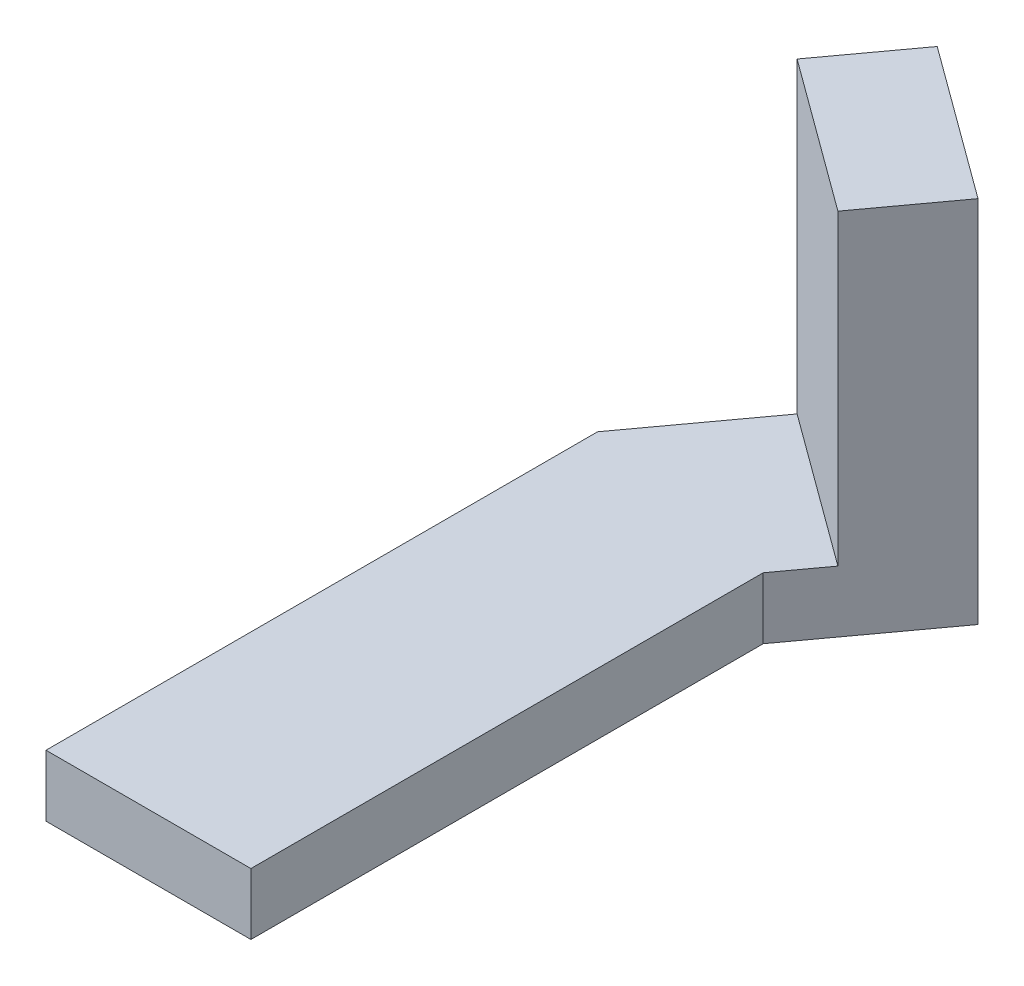
from build123d import *

# Parameters (mm, degrees)
BOSS_EXTRUDE1_DEPTH = 6
BOSS_EXTRUDE2_DEPTH = 30


with BuildPart() as part:
    # Sketch1 → Boss-Extrude1 (new body)
    with BuildSketch(Plane(origin=(0, 0, 0), x_dir=(1, 0, 0), z_dir=(0, 1, 0))):
        Polygon((0, 0), (20, 0), (20, 50), (28.859023883, 62.104449423), (14.00827122, 72.973442133), (0, 53.833363868), align=None)
    extrude(amount=BOSS_EXTRUDE1_DEPTH)

    # Sketch2 → Boss-Extrude2 (add)
    with BuildSketch(Plane(origin=(0, 6, 0), x_dir=(1, 0, 0), z_dir=(0, 1, 0))):
        Polygon((14.00827122, 72.973442133), (8.22967873, 65.077913072), (23.080431394, 54.208920362), (28.859023883, 62.104449423), align=None)
    extrude(amount=BOSS_EXTRUDE2_DEPTH)


solid = part.part
